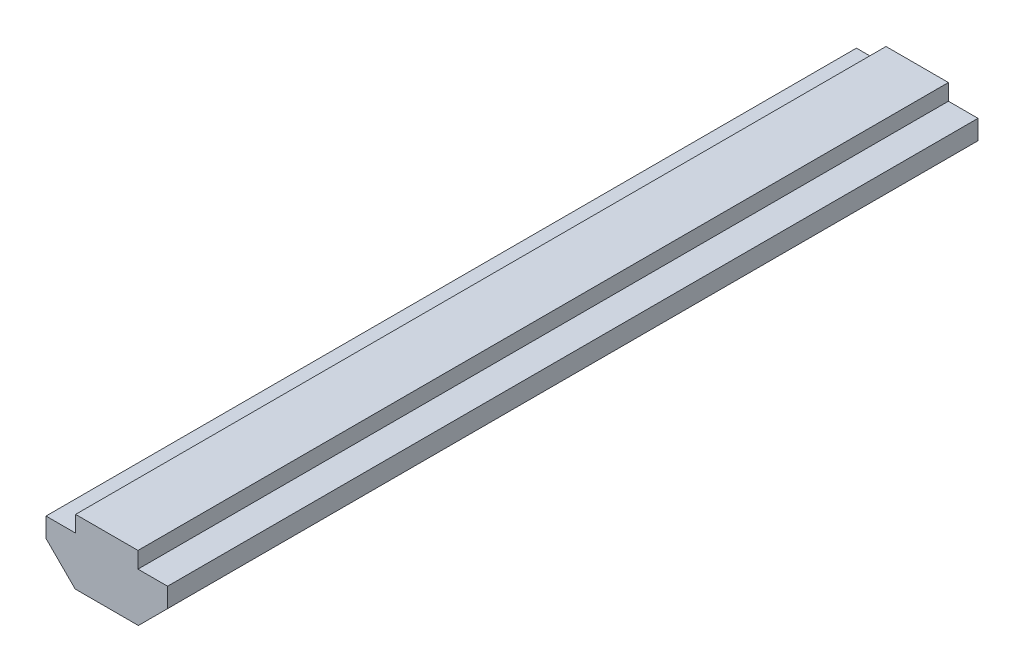
from build123d import *

# Parameters (mm, degrees)
EXTRUDE_1_DEPTH = 100


with BuildPart() as part:
    # 草图1 → 凸台-拉伸1 (new body)
    with BuildSketch(Plane.XY):
        Polygon((11.4, -6), (15, -2.4), (15, 0), (11.35, 0), (11.35, 2), (3.65, 2), (3.65, 0), (0, 0), (0, -2.4), (3.6, -6), align=None)
    extrude(amount=EXTRUDE_1_DEPTH)


solid = part.part
